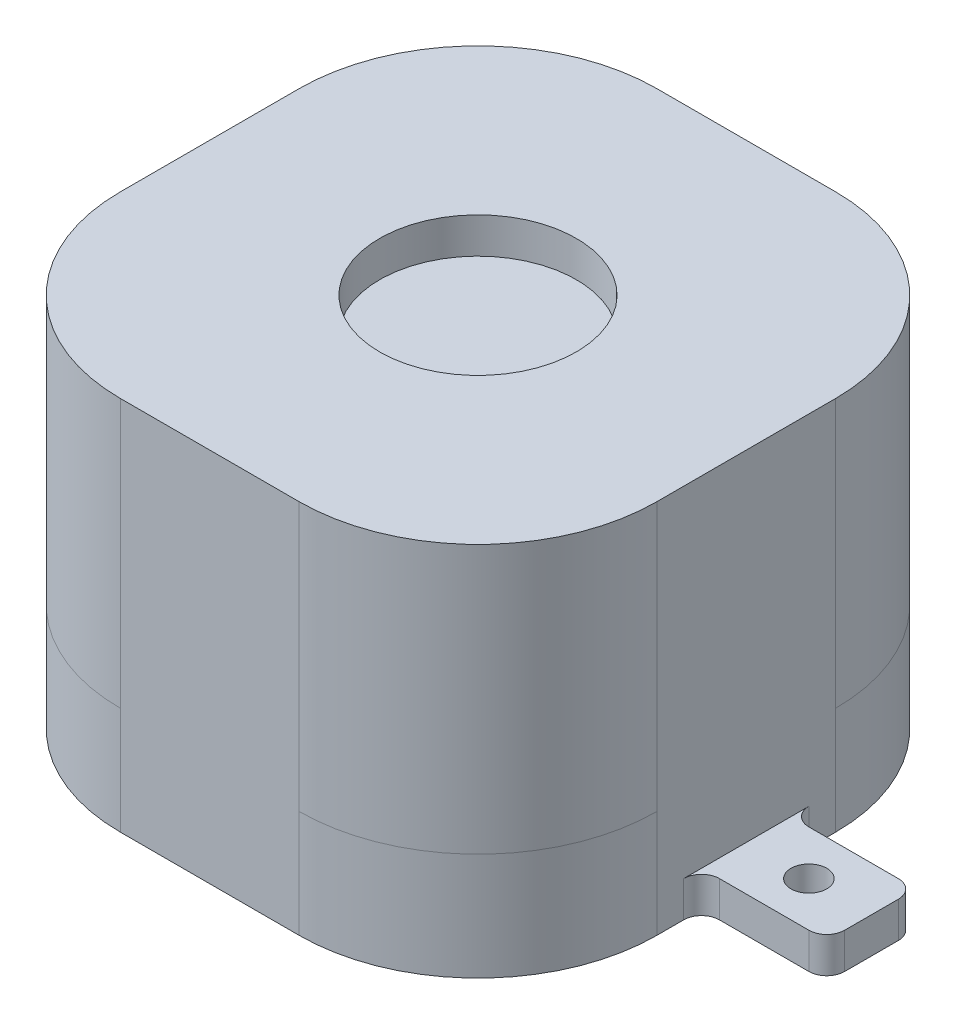
from build123d import *

# Parameters (mm, degrees)
SKETCH1_W           = 30
SKETCH1_H           = 30
BOSS_EXTRUDE1_DEPTH = 6
FILLET1_R           = 10
SKETCH3_W           = 7
SKETCH3_H           = 5
SKETCH3_R           = 1
BOSS_EXTRUDE2_DEPTH = 2
FILLET3_R           = 1
SKETCH4_W           = 30
SKETCH4_H           = 30
BOSS_EXTRUDE3_DEPTH = 15
FILLET4_R           = 10
SKETCH5_R           = 5.5
CUT_EXTRUDE2_DEPTH  = 2


with BuildPart() as part:
    # Sketch1 → Boss-Extrude1 (new body)
    with BuildSketch(Plane(origin=(0, 0, 0), x_dir=(1, 0, 0), z_dir=(0, 1, 0))):
        Rectangle(SKETCH1_W, SKETCH1_H)
    extrude(amount=BOSS_EXTRUDE1_DEPTH)

    # Fillet1
    fillet1_edges = [part.edges().sort_by_distance(p)[0] for p in [
        (-15, 3, -15),
        (15, 3, -15),
        (15, 3, 15),
        (-15, 3, 15),
    ]]
    fillet(fillet1_edges, radius=FILLET1_R)

    # Sketch3 → Boss-Extrude2 (add)
    with BuildSketch(Plane.XZ):
        with Locations((18.5, 0)):
            Rectangle(SKETCH3_W, SKETCH3_H)
        with Locations(Location((18.5, 0, 0), (0, 0, 270))):
            Circle(SKETCH3_R, mode=Mode.SUBTRACT)
    boss_extrude2 = extrude(amount=-BOSS_EXTRUDE2_DEPTH)

    # Mirror1: Boss-Extrude2 across plane
    add(boss_extrude2.mirror(Plane(origin=(0, 0, 0), x_dir=(0, 0, 1), z_dir=(1, 0, 0))))

    # Fillet3
    fillet3_edges = [part.edges().sort_by_distance(p)[0] for p in [
        (15, 1, -2.5),
        (15, 1, 2.5),
        (22, 1, 2.5),
        (22, 1, -2.5),
        (-15, 1, 2.5),
        (-15, 1, -2.5),
        (-22, 1, -2.5),
        (-22, 1, 2.5),
    ]]
    fillet(fillet3_edges, radius=FILLET3_R)

    # Sketch4 → Boss-Extrude3 (add)
    with BuildSketch(Plane(origin=(0, 6, 0), x_dir=(1, 0, 0), z_dir=(0, 1, 0))):
        Rectangle(SKETCH4_W, SKETCH4_H)
    extrude(amount=BOSS_EXTRUDE3_DEPTH)

    # Fillet4
    fillet4_edges = [part.edges().sort_by_distance(p)[0] for p in [
        (15, 13.5, 15),
        (15, 13.5, -15),
        (-15, 13.5, -15),
        (-15, 13.5, 15),
    ]]
    fillet(fillet4_edges, radius=FILLET4_R)

    # Sketch5 → Cut-Extrude2 (cut)
    with BuildSketch(Plane(origin=(0, 21, 0), x_dir=(1, 0, 0), z_dir=(0, 1, 0))):
        with Locations(Location((0, 0, 0), (0, 0, 270))):
            Circle(SKETCH5_R)
    extrude(amount=-CUT_EXTRUDE2_DEPTH, mode=Mode.SUBTRACT)


solid = part.part
